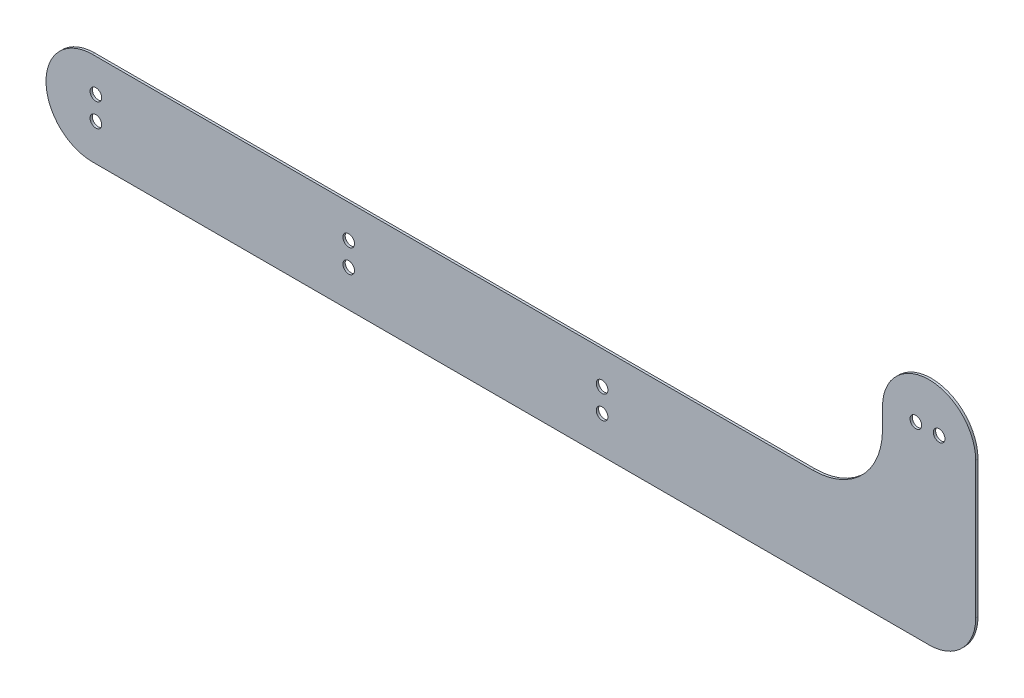
from build123d import *

# Parameters (mm, degrees)
SKETCH1_R           = 2.5
BOSS_EXTRUDE1_DEPTH = 1


with BuildPart() as part:
    # Sketch1 → Boss-Extrude1 (new body)
    with BuildSketch(Plane.XY):
        with BuildLine():
            Line((422.807330172, 62.271616139), (422.807330172, 70.9))
            ThreePointArc((422.807330172, 70.9), (442.807330172, 90.9), (462.807330172, 70.9))
            Line((462.807330172, 70.9), (462.807330172, 12.271616139))
            ThreePointArc((462.807330172, 12.271616139), (456.949465796, -1.870519484), (442.807330172, -7.728383861))
            Line((442.807330172, -7.728383861), (83.711980446, -7.728383861))
            ThreePointArc((83.711980446, -7.728383861), (63.711980446, 12.271616139), (83.711980446, 32.271616139))
            Line((83.711980446, 32.271616139), (392.807330172, 32.271616139))
            ThreePointArc((392.807330172, 32.271616139), (414.020533608, 41.058412704), (422.807330172, 62.271616139))
        make_face()
        with Locations((447.123892989, 72.287469358)):
            Circle(SKETCH1_R, mode=Mode.SUBTRACT)
        with Locations((437.123899958, 72.299275742)):
            Circle(SKETCH1_R, mode=Mode.SUBTRACT)
        with Locations((302.426453747, 8.08188805)):
            Circle(SKETCH1_R, mode=Mode.SUBTRACT)
        with Locations((302.426453747, 18.08188805)):
            Circle(SKETCH1_R, mode=Mode.SUBTRACT)
        with Locations((193.662739564, 8.08188805)):
            Circle(SKETCH1_R, mode=Mode.SUBTRACT)
        with Locations((193.662739564, 18.08188805)):
            Circle(SKETCH1_R, mode=Mode.SUBTRACT)
        with Locations((85.113521615, 8.08188805)):
            Circle(SKETCH1_R, mode=Mode.SUBTRACT)
        with Locations((85.129858985, 18.081874704)):
            Circle(SKETCH1_R, mode=Mode.SUBTRACT)
    extrude(amount=BOSS_EXTRUDE1_DEPTH)


solid = part.part
